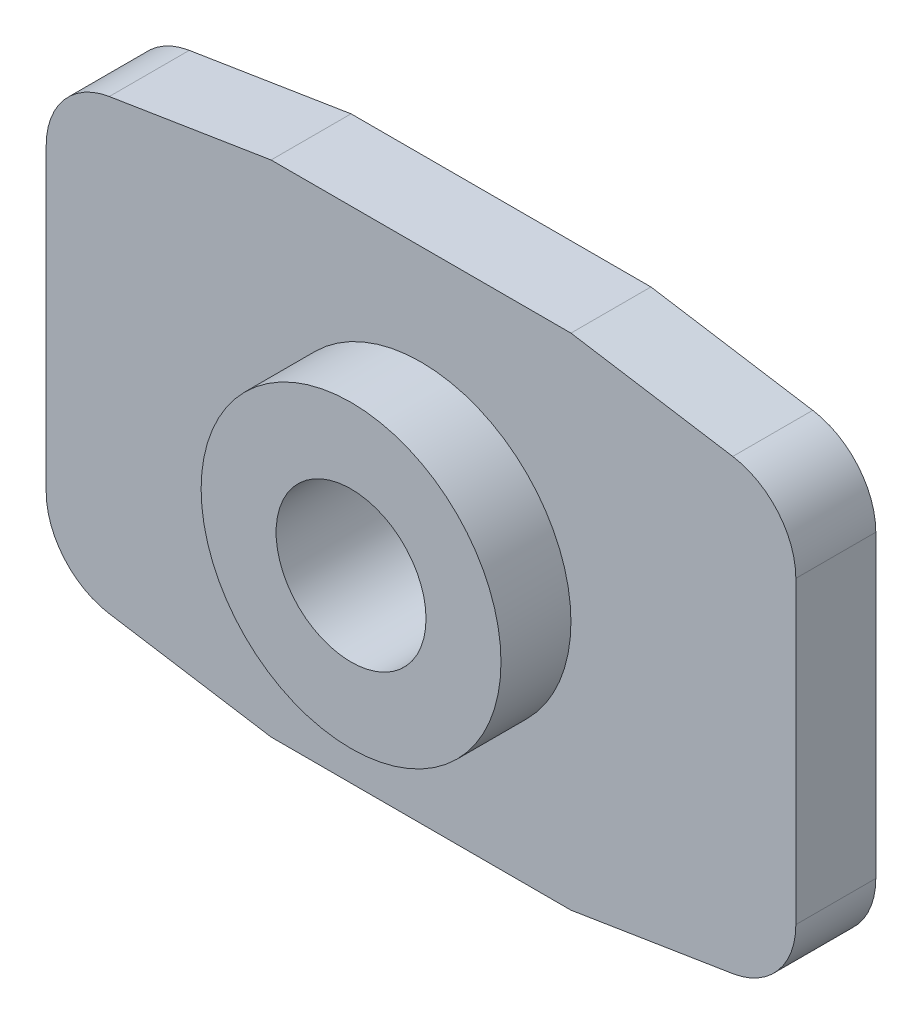
from build123d import *

# Parameters (mm, degrees)
BOSS_EXTRUDE1_DEPTH   = 1.6
SKETCH2_R             = 3
BOSS_EXTRUDE2_DEPTH   = 1.4
M5X0_8_TAPPED_HOLE1_D = 3


with BuildPart() as part:
    # Sketch1 → Boss-Extrude1 (new body)
    with BuildSketch(Plane.XY):
        with BuildLine():
            Line((-6.237396753, 4.481095129), (-3, 5))
            Line((-3, 5), (3, 5))
            Line((3, 5), (6.237396753, 4.481095129))
            ThreePointArc((6.237396753, 4.481095129), (7.141511088, 3.973114811), (7.5, 3))
            Line((7.5, 3), (7.5, -3))
            ThreePointArc((7.5, -3), (7.141511088, -3.973114811), (6.237396753, -4.481095129))
            Line((6.237396753, -4.481095129), (3, -5))
            Line((3, -5), (-3, -5))
            Line((-3, -5), (-6.237396753, -4.481095129))
            ThreePointArc((-6.237396753, -4.481095129), (-7.141511088, -3.973114811), (-7.5, -3))
            Line((-7.5, -3), (-7.5, 3))
            ThreePointArc((-7.5, 3), (-7.141511088, 3.973114811), (-6.237396753, 4.481095129))
        make_face()
    extrude(amount=BOSS_EXTRUDE1_DEPTH)

    # Sketch2 → Boss-Extrude2 (add)
    with BuildSketch(Plane.XY.offset(1.6)):
        Circle(SKETCH2_R)
    extrude(amount=BOSS_EXTRUDE2_DEPTH)

    # M5x0.8 Tapped Hole1 (through all)
    with Locations(Plane.XY.offset(3)):
        with Locations((0, 0)):
            Hole(M5X0_8_TAPPED_HOLE1_D / 2)


solid = part.part
